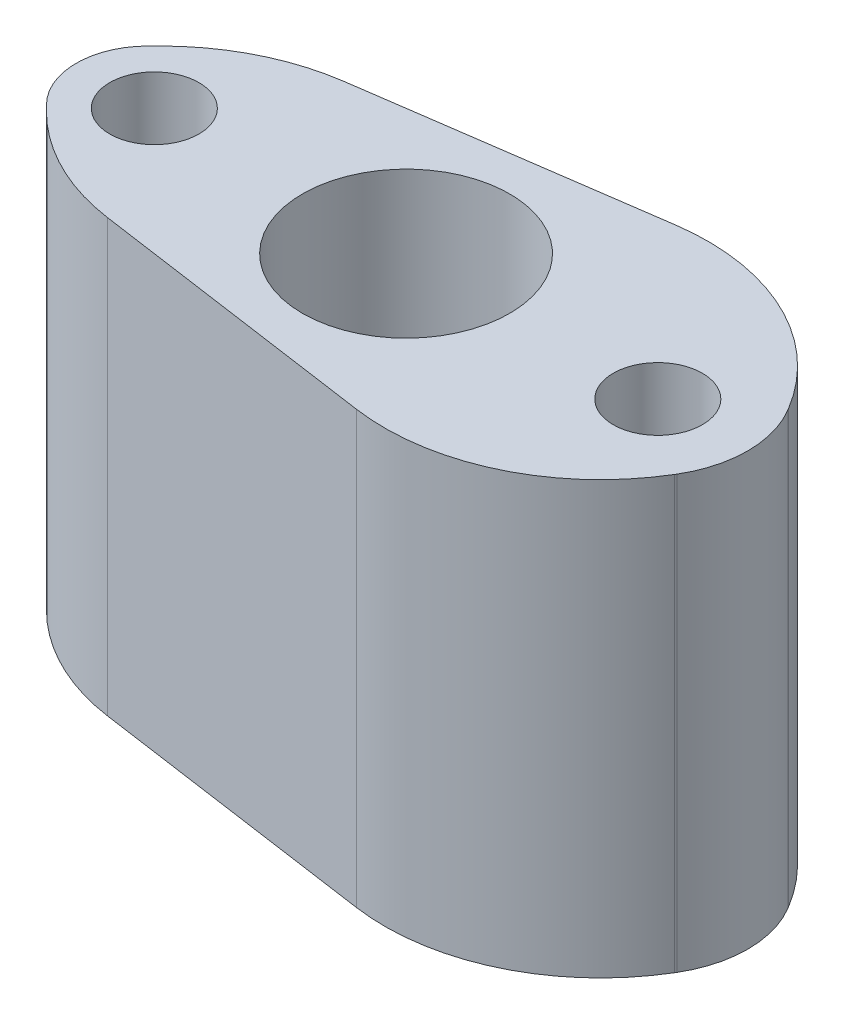
from build123d import *

# Parameters (mm, degrees)
SKETCH1_R           = 0.72
SKETCH1_R_2         = 0.31
BOSS_EXTRUDE1_DEPTH = 3


with BuildPart() as part:
    # Sketch1 → Boss-Extrude1 (new body)
    with BuildSketch(Plane(origin=(0, 0, 0), x_dir=(1, 0, 0), z_dir=(0, 1, 0))):
        with BuildLine():
            Line((2.26851387, 0.385599784), (2.262386582, 0.395814417))
            ThreePointArc((2.262386582, 0.395814417), (1.620794549, 0.978580721), (0.763932274, 1.109133182))
            Line((0.763932274, 1.109133182), (-1.255025253, 0.820710678))
            ThreePointArc((-1.255025253, 0.820710678), (-1.713713612, 0.677427224), (-2.103553391, 0.396446609))
            Line((-2.103553391, 0.396446609), (-2.146446609, 0.353553391))
            ThreePointArc((-2.146446609, 0.353553391), (-2.292893219, 0), (-2.146446609, -0.353553391))
            Line((-2.146446609, -0.353553391), (-2.103553391, -0.396446609))
            ThreePointArc((-2.103553391, -0.396446609), (-1.713713612, -0.677427224), (-1.255025253, -0.820710678))
            Line((-1.255025253, -0.820710678), (0.76415397, -1.109164853))
            ThreePointArc((0.76415397, -1.109164853), (1.620875906, -0.978679189), (2.262448348, -0.396112639))
            Line((2.262448348, -0.396112639), (2.268433905, -0.386138967))
            ThreePointArc((2.268433905, -0.386138967), (2.375352729, -0.000280666), (2.26851387, 0.385599784))
        make_face()
        with Locations(Location((0, 0, 0), (0, 0, 270))):
            Circle(SKETCH1_R, mode=Mode.SUBTRACT)
        with Locations(Location((1.75, 0, 0), (0, 0, 270))):
            Circle(SKETCH1_R_2, mode=Mode.SUBTRACT)
        with Locations(Location((-1.75, 0, 0), (0, 0, 270))):
            Circle(SKETCH1_R_2, mode=Mode.SUBTRACT)
    extrude(amount=BOSS_EXTRUDE1_DEPTH)


solid = part.part
